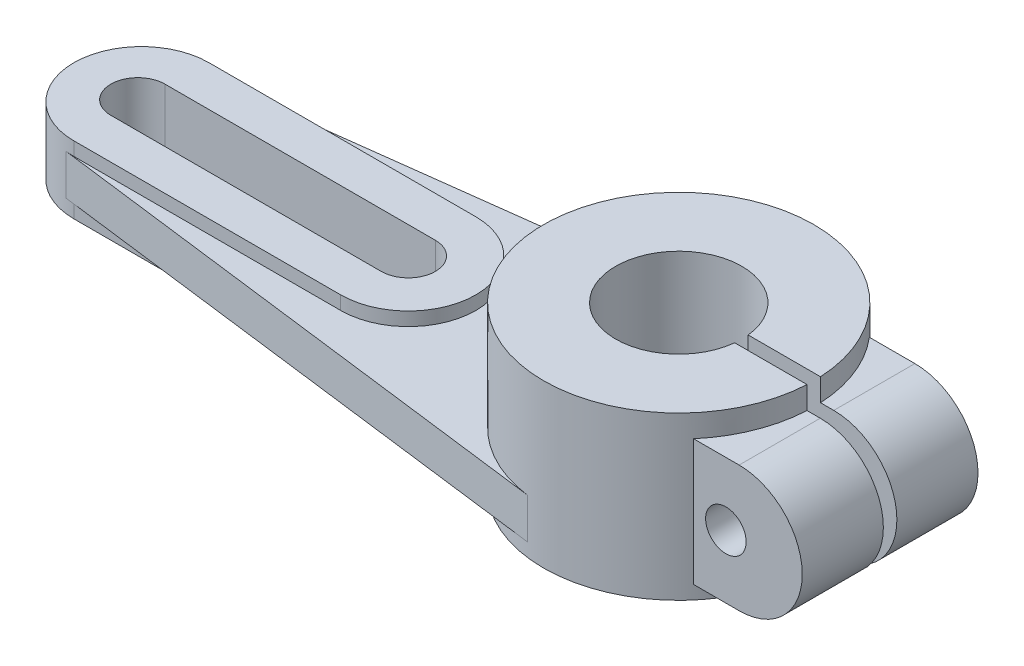
from build123d import *

# Parameters (mm, degrees)
BOSS_EXTRUDE1_DEPTH = 7.5
BOSS_EXTRUDE2_DEPTH = 4.5
BOSS_EXTRUDE3_START = 28.5
BOSS_EXTRUDE3_DEPTH = 36
BOSS_EXTRUDE4_START = 23.5
SKETCH1_5_W         = 16.939679335
SKETCH1_5_H         = 18
BOSS_EXTRUDE4_DEPTH = 28
FILLET1_RADIUS      = 14
FILLET1_LENGTH      = 18
FILLET2_RADIUS      = 14
FILLET2_LENGTH      = 18
SKETCH2_R           = 4.5
CUT_EXTRUDE1_DEPTH  = 146.8618303


with BuildPart() as part:
    # Sketch1 → Boss-Extrude1 (new, symmetric)
    with BuildSketch(Plane(origin=(0, 0, 0), x_dir=(1, 0, 0), z_dir=(0, 1, 0))):
        with BuildLine():
            Line((-119.21316455, -15), (-60, -15))
            ThreePointArc((-60, -15), (-45, 0), (-60, 15))
            Line((-60, 15), (-119.21316455, 15))
            ThreePointArc((-119.21316455, 15), (-134.21316455, 0), (-119.21316455, -15))
        make_face()
        with BuildLine():
            ThreePointArc((-120, 6), (-126, 0), (-120, -6))
            Line((-120, -6), (-60, -6))
            ThreePointArc((-60, -6), (-54, 0), (-60, 6))
            Line((-60, 6), (-120, 6))
        make_face(mode=Mode.SUBTRACT)
    extrude(amount=BOSS_EXTRUDE1_DEPTH, both=True)

    # Sketch1<3> → Boss-Extrude2 (add, symmetric)
    with BuildSketch(Plane(origin=(0, 0, 0), x_dir=(1, 0, 0), z_dir=(0, 1, 0))):
        with BuildLine():
            ThreePointArc((-121.100539999, 14.880786737), (-120.158732883, 14.970167017), (-119.21316455, 15))
            Line((-119.21316455, 15), (-60, 15))
            ThreePointArc((-60, 15), (-45, 0), (-60, -15))
            Line((-60, -15), (-119.21316455, -15))
            ThreePointArc((-119.21316455, -15), (-120.158732883, -14.970167017), (-121.100539999, -14.880786737))
            Line((-121.100539999, -14.880786737), (-3.774750899, -29.761573474))
            ThreePointArc((-3.774750899, -29.761573474), (-30, 0), (-3.774750899, 29.761573474))
            Line((-3.774750899, 29.761573474), (-121.100539999, 14.880786737))
        make_face()
    extrude(amount=BOSS_EXTRUDE2_DEPTH, both=True)

    # Sketch1<4> → Boss-Extrude3 (add)
    with BuildSketch(Plane(origin=(0, 0, 0), x_dir=(1, 0, 0), z_dir=(0, 1, 0)).offset(BOSS_EXTRUDE3_START)):
        with BuildLine():
            ThreePointArc((29.962476533, 1.5), (-30, 0), (29.962476533, -1.5))
            Line((29.962476533, -1.5), (13.919410907, -1.5))
            ThreePointArc((13.919410907, -1.5), (-14, 0), (13.919410907, 1.5))
            Line((13.919410907, 1.5), (29.962476533, 1.5))
        make_face()
    extrude(amount=-BOSS_EXTRUDE3_DEPTH)

    # Sketch1<5> → Boss-Extrude4 (add)
    with BuildSketch(Plane(origin=(0, 0, 0), x_dir=(1, 0, 0), z_dir=(0, 1, 0)).offset(BOSS_EXTRUDE4_START)):
        with BuildLine():
            ThreePointArc((29.962476533, -1.5), (27.873242778, -11.094247926), (22.79802623, -19.5))
            Line((22.79802623, -19.5), (29.962476533, -19.5))
            Line((29.962476533, -19.5), (29.962476533, -1.5))
        make_face()
        with Locations((38.4323162, -10.5)):
            Rectangle(SKETCH1_5_W, SKETCH1_5_H)
        with Locations((38.4323162, 10.5)):
            Rectangle(SKETCH1_5_W, SKETCH1_5_H)
        with BuildLine():
            Line((29.962476533, 19.5), (22.79802623, 19.5))
            ThreePointArc((22.79802623, 19.5), (27.873242778, 11.094247926), (29.962476533, 1.5))
            Line((29.962476533, 1.5), (29.962476533, 19.5))
        make_face()
    extrude(amount=-BOSS_EXTRUDE4_DEPTH)

    # Fillet1: full round fillet: the end face becomes a half cylinder, R = half its width
    fillet1_face = Plane((46.902155868, 9.5, 10.5), x_dir=(0, 0, -1), z_dir=(1, 0, 0))  # on the end face: x along it, z out of the body
    fillet1_slab = fillet1_face.offset(-FILLET1_RADIUS / 2) * Box(FILLET1_LENGTH, 2 * FILLET1_RADIUS, FILLET1_RADIUS, mode=Mode.PRIVATE)  # the body's end, R deep
    fillet1_round = Plane((32.902155868, 9.5, 10.5), x_dir=(1, 0, 0), z_dir=(0, 0, -1)) * Cylinder(FILLET1_RADIUS, FILLET1_LENGTH, mode=Mode.PRIVATE)  # its axis R under the face
    add(fillet1_slab - fillet1_round, mode=Mode.SUBTRACT)

    # Fillet2: full round fillet: the end face becomes a half cylinder, R = half its width
    fillet2_face = Plane((46.902155868, 9.5, -10.5), x_dir=(0, 0, 1), z_dir=(1, 0, 0))  # on the end face: x along it, z out of the body
    fillet2_slab = fillet2_face.offset(-FILLET2_RADIUS / 2) * Box(FILLET2_LENGTH, 2 * FILLET2_RADIUS, FILLET2_RADIUS, mode=Mode.PRIVATE)  # the body's end, R deep
    fillet2_round = Plane((32.902155868, 9.5, -10.5), x_dir=(1, 0, 0), z_dir=(0, 0, 1)) * Cylinder(FILLET2_RADIUS, FILLET2_LENGTH, mode=Mode.PRIVATE)  # its axis R under the face
    add(fillet2_slab - fillet2_round, mode=Mode.SUBTRACT)

    # Sketch2 → Cut-Extrude1 (cut, through all)
    with BuildSketch(Plane.XY.offset(19.5)):
        with Locations(Location((29.962476533, 9.5, 0), (0, 0, 180))):
            Circle(SKETCH2_R)
    extrude(amount=-CUT_EXTRUDE1_DEPTH, mode=Mode.SUBTRACT)


solid = part.part
